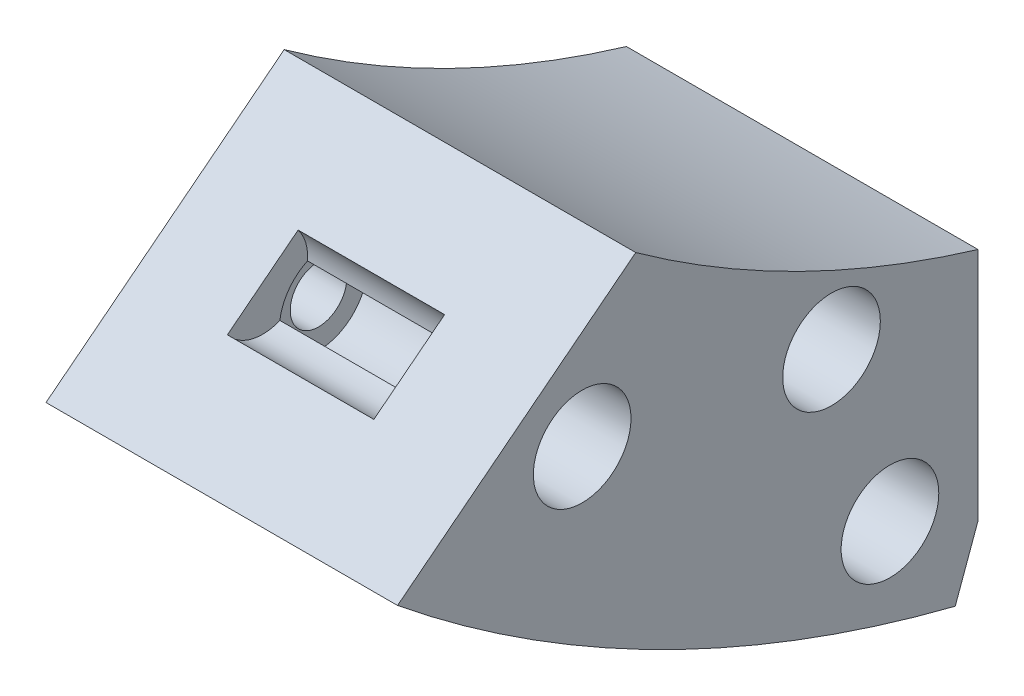
from build123d import *

# Parameters (mm, degrees)
BOSS_EXTRUDE1_DEPTH              = 5
BOSS_EXTRUDE2_DEPTH              = 13
CUT_EXTRUDE1_START               = -13
SKETCH3_R                        = 2.3
CUT_EXTRUDE1_DEPTH               = 7.5
CUT_EXTRUDE2_DEPTH               = 57.683541142
CUT_EXTRUDE2_DEPTH_BACK          = 57.683541142
CBORE_FOR_M2_5_SHCS1_D           = 2.9
CBORE_FOR_M2_5_SHCS1_CBORE_D     = 5
CBORE_FOR_M2_5_SHCS1_CBORE_DEPTH = 13.5


with BuildPart() as part:
    # Sketch1 → Boss-Extrude1 (new body)
    with BuildSketch(Plane(origin=(0, 0, 0), x_dir=(0, 0, -1), z_dir=(1, 0, 0))):
        with BuildLine():
            Line((-34.593659354, 3.256520294), (-46.7897518, -6.296129983))
            ThreePointArc((-46.7897518, -6.296129983), (-33.290290023, -15.004245976), (-18.234604608, -20.60719958))
            Line((-18.234604608, -20.60719958), (-2.973495544, 21.32235297))
            Line((-2.973495544, 21.32235297), (-17.068884855, 26.45265512))
            Line((-17.068884855, 26.45265512), (-27.166620772, -1.290646299))
            ThreePointArc((-27.166620772, -1.290646299), (-30.963724442, 0.846415848), (-34.593659354, 3.256520294))
        make_face()
    extrude(amount=BOSS_EXTRUDE1_DEPTH)

    # Sketch2 → Boss-Extrude2 (add)
    with BuildSketch(Plane(origin=(5, 0, 0), x_dir=(0, 0, -1), z_dir=(1, 0, 0))):
        with BuildLine():
            Line((-34.593659354, 3.256520294), (-46.7897518, -6.296129983))
            ThreePointArc((-46.7897518, -6.296129983), (-42.613802597, -9.444548196), (-38.226724688, -12.291412509))
            Line((-38.226724688, -12.291412509), (-25.335917908, -2.194623762))
            ThreePointArc((-25.335917908, -2.194623762), (-26.255160174, -1.750514609), (-27.166620772, -1.290646299))
            ThreePointArc((-27.166620772, -1.290646299), (-30.963724442, 0.846415848), (-34.593659354, 3.256520294))
        make_face()
        with BuildLine():
            Line((-25.335917908, -2.194623762), (-38.226724688, -12.291412509))
            ThreePointArc((-38.226724688, -12.291412509), (-28.535215176, -17.181480963), (-18.234604608, -20.60719958))
            Line((-18.234604608, -20.60719958), (-12.16072752, -3.919359432))
            Line((-12.16072752, -3.919359432), (-2.973495544, 21.32235297))
            Line((-2.973495544, 21.32235297), (-17.068884855, 26.45265512))
            Line((-17.068884855, 26.45265512), (-26.256116832, 1.210942718))
            Line((-26.256116832, 1.210942718), (-27.166620772, -1.290646299))
            ThreePointArc((-27.166620772, -1.290646299), (-26.255160174, -1.750514609), (-25.335917908, -2.194623762))
        make_face()
    extrude(amount=BOSS_EXTRUDE2_DEPTH)

    # Sketch3 → Cut-Extrude1 (cut)
    with BuildSketch(Plane(origin=(18, 0, 0), x_dir=(0, 0, -1), z_dir=(1, 0, 0)).offset(CUT_EXTRUDE1_START)):
        with Locations((-40.691705577, -1.519804845)):
            Circle(SKETCH3_R)
    extrude(amount=CUT_EXTRUDE1_DEPTH, mode=Mode.SUBTRACT)

    # Sketch8 → Cut-Extrude2 (cut, two sides: drawn at the far end of the back side and taken through both)
    with BuildSketch(Plane.ZY.offset(-CUT_EXTRUDE2_DEPTH_BACK)):
        with BuildLine():
            Line((27.166620772, -1.290646299), (17.068884855, 26.45265512))
            Line((17.068884855, 26.45265512), (2.973495544, 21.32235297))
            Line((2.973495544, 21.32235297), (17.068884855, -17.404410883))
            Line((17.068884855, -17.404410883), (17.068884855, -5.36984615))
            ThreePointArc((17.068884855, -5.36984615), (22.211595111, -3.562545394), (27.166620772, -1.290646299))
        make_face()
    extrude(amount=CUT_EXTRUDE2_DEPTH + CUT_EXTRUDE2_DEPTH_BACK, mode=Mode.SUBTRACT)

    # CBORE for M2.5 SHCS1 (through all)
    with Locations(Plane(origin=(18, 0, 0), x_dir=(0, 0, -1), z_dir=(1, 0, 0))):
        with Locations((-37.335347169, -3.97184687), (-24.568884855, -6.047927384), (-21.576904852, -15.17107203)):
            CounterBoreHole(CBORE_FOR_M2_5_SHCS1_D / 2, CBORE_FOR_M2_5_SHCS1_CBORE_D / 2, CBORE_FOR_M2_5_SHCS1_CBORE_DEPTH)


solid = part.part
